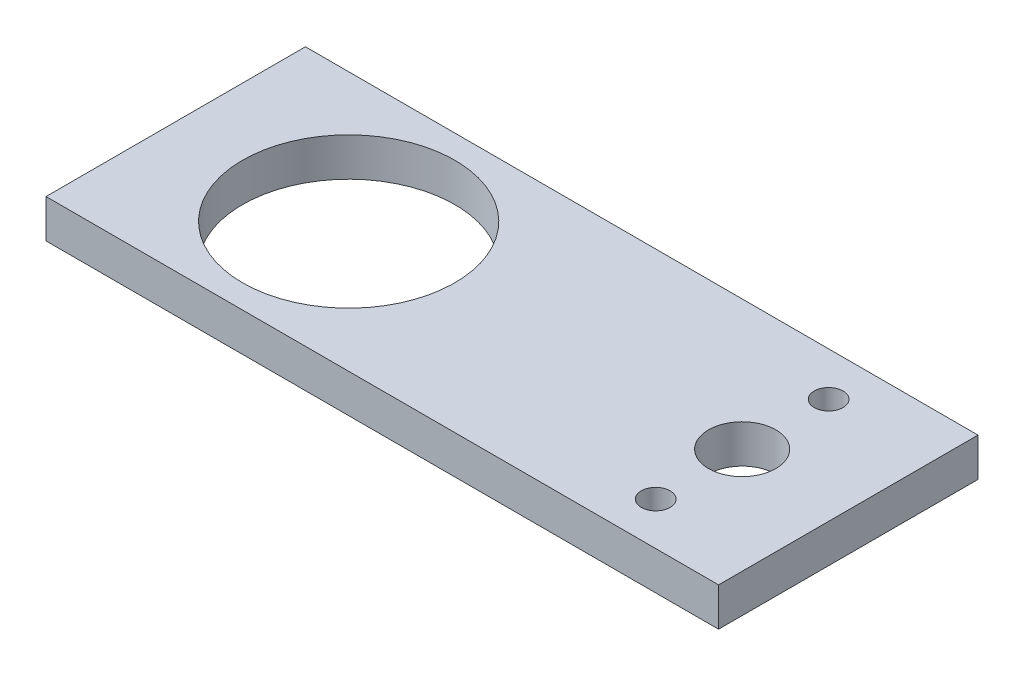
from build123d import *

# Parameters (mm, degrees)
SKETCH1_W           = 70
SKETCH1_H           = 27
SKETCH1_R           = 3.5
SKETCH1_R_2         = 1.5
SKETCH1_R_3         = 11.05
BOSS_EXTRUDE1_DEPTH = 4


with BuildPart() as part:
    # Sketch1 → Boss-Extrude1 (new body)
    with BuildSketch(Plane(origin=(0, 0, 0), x_dir=(1, 0, 0), z_dir=(0, 1, 0))):
        with Locations((-6.595008658, -2.605849582)):
            Rectangle(SKETCH1_W, SKETCH1_H)
        with Locations(Location((17.404991342, -2.650659049, 0), (0, 0, 270))):
            Circle(SKETCH1_R, mode=Mode.SUBTRACT)
        with Locations(Location((17.404991342, 6.349340951, 0), (0, 0, 270))):
            Circle(SKETCH1_R_2, mode=Mode.SUBTRACT)
        with Locations(Location((17.404991342, -11.650659049, 0), (0, 0, 270))):
            Circle(SKETCH1_R_2, mode=Mode.SUBTRACT)
        with Locations(Location((-23.595008658, -2.605849582, 0), (0, 0, 270))):
            Circle(SKETCH1_R_3, mode=Mode.SUBTRACT)
    extrude(amount=BOSS_EXTRUDE1_DEPTH)


solid = part.part
